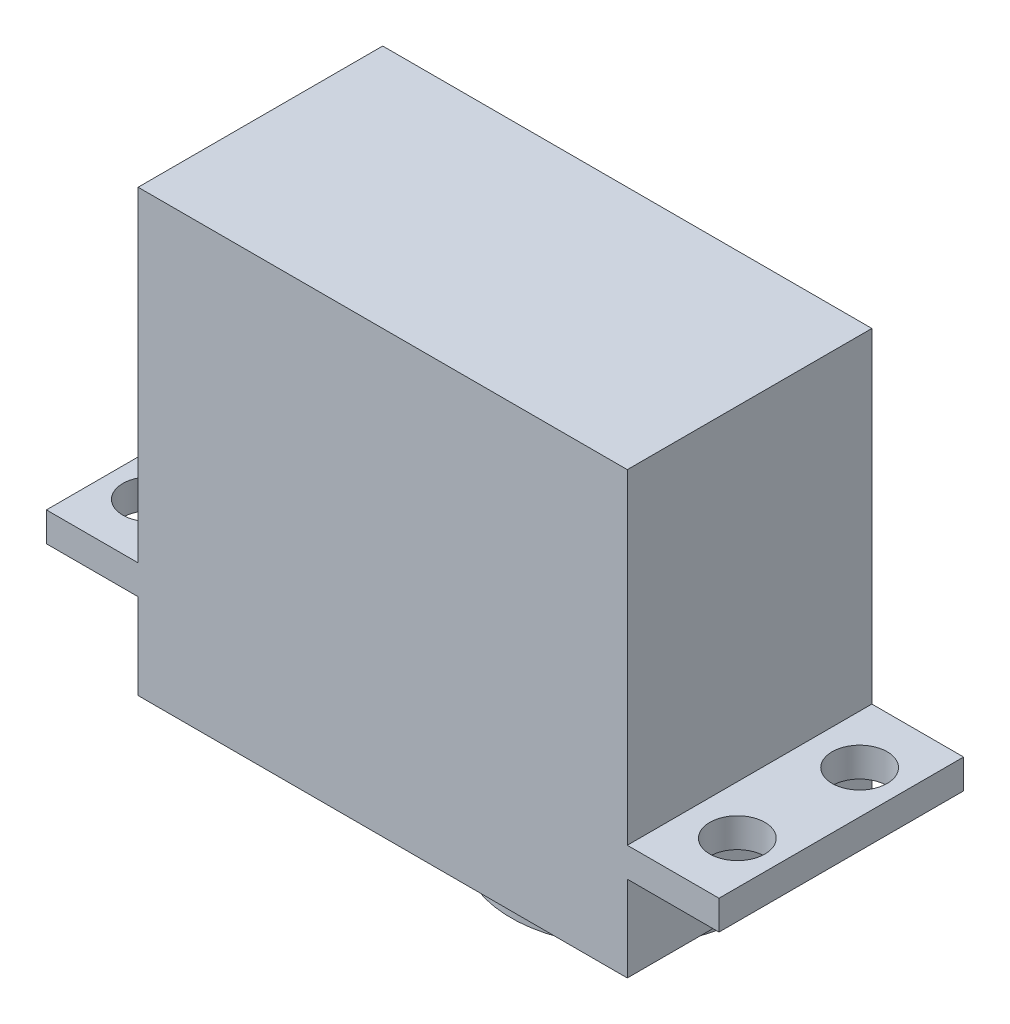
from build123d import *

# Parameters (mm, degrees)
SKETCH1_W            = 40
SKETCH1_H            = 20
BOSS_EXTRUDE1_DEPTH  = 36
SKETCH2_W            = 55
SKETCH2_H            = 20
BOSS_EXTRUDE2_DEPTH  = 2.4
M4_CLEARANCE_HOLE1_D = 4.5
SKETCH5_R            = 9.5
BOSS_EXTRUDE3_DEPTH  = 1


with BuildPart() as part:
    # Sketch1 → Boss-Extrude1 (new body)
    with BuildSketch(Plane(origin=(0, 0, 0), x_dir=(1, 0, 0), z_dir=(0, 1, 0))):
        Rectangle(SKETCH1_W, SKETCH1_H)
    extrude(amount=BOSS_EXTRUDE1_DEPTH)

    # Sketch2 → Boss-Extrude2 (add)
    with BuildSketch(Plane(origin=(0, 7, 0), x_dir=(1, 0, 0), z_dir=(0, 1, 0))):
        Rectangle(SKETCH2_W, SKETCH2_H)
    extrude(amount=BOSS_EXTRUDE2_DEPTH)

    # M4 Clearance Hole1 (through all)
    with Locations(Plane(origin=(0, 7, 0), x_dir=(-1, 0, 0), z_dir=(0, -1, 0))):
        with Locations((-24, 5), (-24, -5)):
            m4_clearance_hole1 = Hole(M4_CLEARANCE_HOLE1_D / 2)

    # Mirror1: M4 Clearance Hole1 across plane
    add(m4_clearance_hole1.mirror(Plane(origin=(0, 0, 0), x_dir=(0, 0, 1), z_dir=(1, 0, 0))), mode=Mode.SUBTRACT)

    # Sketch5 → Boss-Extrude3 (add)
    with BuildSketch(Plane.XZ):
        with Locations(Location((10, 0, 0), (0, 0, 270))):
            Circle(SKETCH5_R)
    extrude(amount=BOSS_EXTRUDE3_DEPTH)


solid = part.part
